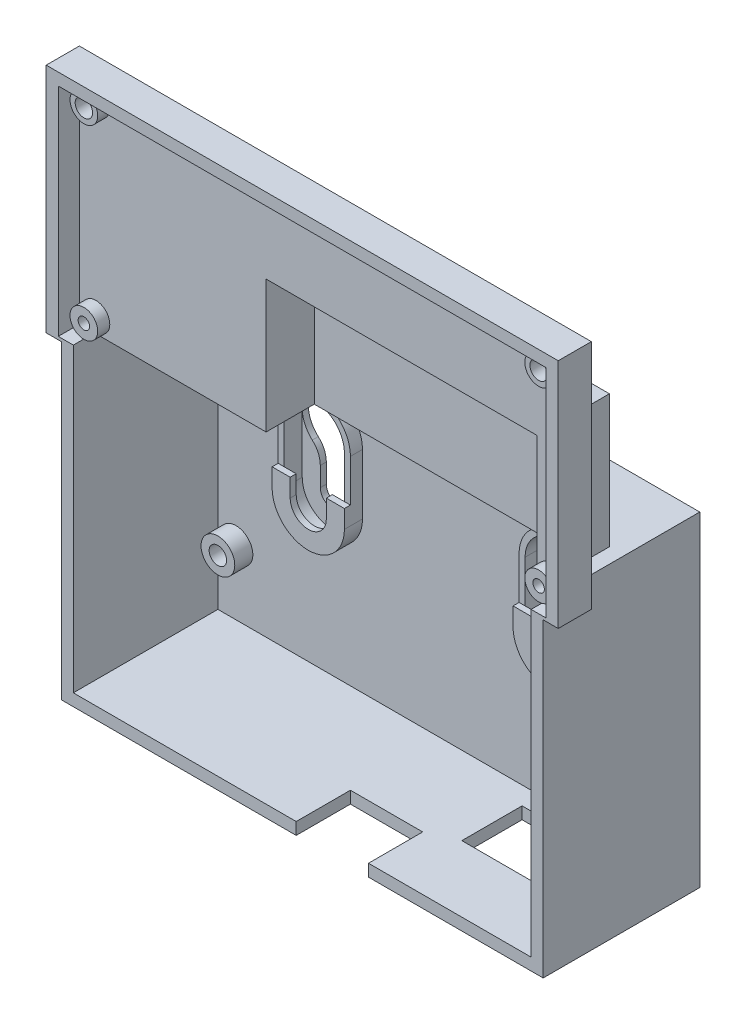
from build123d import *
from build123d.topology import SkipClean

# Parameters (mm, degrees)
SKETCH_1_W           = 80
SKETCH_1_H           = 54
SKETCH_1_W_2         = 76
SKETCH_1_H_2         = 50
EXTRUDE_1_DEPTH      = 24
SKETCH_2_W           = 80
SKETCH_2_H           = 54
EXTRUDE_1_2_DEPTH    = 2
SKETCH_3_R           = 2.8
SKETCH_3_R_2         = 1.45
EXTRUDE_4_DEPTH      = 3
SKETCH_4_W           = 16
SKETCH_4_H           = 10
SKETCH_4_W_2         = 12
SKETCH_4_H_2         = 9
CUT_EXTRUDE_1_DEPTH  = 2
SKETCH_6_W           = 10
SKETCH_6_H           = 12.5
CUT_EXTRUDE_2_DEPTH  = 2
CUT_EXTRUDE_START    = -2
SKETCH_7_R           = 1.45
CUT_EXTRUDE_3_DEPTH  = 2
SKETCH_8_W           = 81
SKETCH_8_H           = 5.5
CUT_EXTRUDE_4_DEPTH  = 2
EXTRUDE_5_DEPTH      = 2
EXTRUDE_6_DEPTH      = 3.5
SKETCH_11_W          = 45
SKETCH_11_H          = 22
CUT_EXTRUDE_5_DEPTH  = 8
EXTRUDE_7_DEPTH      = 6
SKETCH_13_W          = 53
SKETCH_13_H          = 22
EXTRUDE_8_DEPTH      = 2
SKETCH_14_R          = 2.3
SKETCH_14_R_2        = 1.45
SKETCH_14_R_3        = 0.95
EXTRUDE_9_DEPTH      = 2
SKETCH_15_R          = 1.45
CUT_EXTRUDE_6_DEPTH  = 2
EXTRUDE_10_DEPTH     = 2
CUT_EXTRUDE_7_DEPTH  = 2
EXTRUDE_11_DEPTH     = 1
CUT_EXTRUDE_START_2  = -1
CUT_EXTRUDE_8_DEPTH  = 1
SKETCH_20_R          = 3
CUT_EXTRUDE_9_DEPTH  = 1
SKETCH_21_R          = 3
CUT_EXTRUDE_10_DEPTH = 1


with BuildPart() as part:
    # Эскиз1 → Extrude 1 (new body)
    with BuildSketch(Plane.XY):
        Rectangle(SKETCH_1_W, SKETCH_1_H)
        Rectangle(SKETCH_1_W_2, SKETCH_1_H_2, mode=Mode.SUBTRACT)
    extrude(amount=EXTRUDE_1_DEPTH)

    # Эскиз2 → Extrude 1 2 (add)
    with BuildSketch(Plane(origin=(0, 0, 0), x_dir=(-1, 0, 0), z_dir=(0, 0, -1))):
        Rectangle(SKETCH_2_W, SKETCH_2_H)
    extrude(amount=EXTRUDE_1_2_DEPTH)

    # Эскиз3 → Бобышка-Вытянуть4 (add)
    # profile 1 of 4: a face of its own
    with BuildSketch(Plane.XY):
        with Locations((35, 19.75)):
            Circle(SKETCH_3_R)
        with Locations((35, 19.75)):
            Circle(SKETCH_3_R_2, mode=Mode.SUBTRACT)
    # profile 2 of 4: a face of its own
    with BuildSketch(Plane.XY):
        with Locations((35, -14.25)):
            Circle(SKETCH_3_R)
        with Locations((35, -14.25)):
            Circle(SKETCH_3_R_2, mode=Mode.SUBTRACT)
    # profile 3 of 4: a face of its own
    with BuildSketch(Plane.XY):
        with Locations((-35, -14.25)):
            Circle(SKETCH_3_R)
        with Locations((-35, -14.25)):
            Circle(SKETCH_3_R_2, mode=Mode.SUBTRACT)
    # profile 4 of 4: a face of its own
    with BuildSketch(Plane.XY):
        with Locations((-35, 19.75)):
            Circle(SKETCH_3_R)
        with Locations((-35, 19.75)):
            Circle(SKETCH_3_R_2, mode=Mode.SUBTRACT)
    extrude(amount=EXTRUDE_4_DEPTH)

    # Эскиз4 → Вырез-Вытянуть1 (cut)
    with BuildSketch(Plane.XZ.offset(27)):
        with Locations((23.5, 8)):
            Rectangle(SKETCH_4_W, SKETCH_4_H)
        with Locations((5, 19.5)):
            Rectangle(SKETCH_4_W_2, SKETCH_4_H_2)
    extrude(amount=-CUT_EXTRUDE_1_DEPTH, mode=Mode.SUBTRACT)

    # Эскиз6 → Вырез-Вытянуть2 (cut)
    with BuildSketch(Plane(origin=(0, 27, 0), x_dir=(1, 0, 0), z_dir=(0, 1, 0))):
        with Locations((-26.5, -10.25)):
            Rectangle(SKETCH_6_W, SKETCH_6_H)
    extrude(amount=-CUT_EXTRUDE_2_DEPTH, mode=Mode.SUBTRACT)

    # Эскиз7 → Вырез-Вытянуть3 (cut)
    with BuildSketch(Plane.XY.offset(CUT_EXTRUDE_START)):
        with Locations((-35, 19.75)):
            Circle(SKETCH_7_R)
        with Locations((-35, -14.25)):
            Circle(SKETCH_7_R)
        with Locations((35, 19.75)):
            Circle(SKETCH_7_R)
        with Locations((35, -14.25)):
            Circle(SKETCH_7_R)
    extrude(amount=CUT_EXTRUDE_3_DEPTH, mode=Mode.SUBTRACT)

    # Эскиз8 → Вырез-Вытянуть4 (cut)
    with BuildSketch(Plane(origin=(0, 27, 0), x_dir=(1, 0, 0), z_dir=(0, 1, 0))):
        with Locations((0, -21.25)):
            Rectangle(SKETCH_8_W, SKETCH_8_H)
    extrude(amount=-CUT_EXTRUDE_4_DEPTH, mode=Mode.SUBTRACT)

    # Эскиз9 → Бобышка-Вытянуть5 (add)
    with BuildSketch(Plane.XY.offset(18.5)):
        Polygon((42.5, 25), (42.5, 63), (-42.5, 63), (-42.5, 25), (-42.5, 24.5), (-40, 24.5), (-40, 25), (40, 25), (40, 24.5), (42.5, 24.5), align=None)
    extrude(amount=EXTRUDE_5_DEPTH)

    # Эскиз10 → Бобышка-Вытянуть6 (add)
    with BuildSketch(Plane.XY.offset(20.5)):
        Polygon((40.5, 25), (40.5, 61), (-40.5, 61), (-40.5, 25), (-40, 25), (-40, 24.5), (-42.5, 24.5), (-42.5, 25), (-42.5, 63), (42.5, 63), (42.5, 25), (42.5, 24.5), (40, 24.5), (40, 25), align=None)
    extrude(amount=EXTRUDE_6_DEPTH)

    # Эскиз11 → Вырез-Вытянуть5 (cut)
    with BuildSketch(Plane.XY.offset(20.5)):
        with Locations((13, 36)):
            Rectangle(SKETCH_11_W, SKETCH_11_H)
    extrude(amount=-CUT_EXTRUDE_5_DEPTH, mode=Mode.SUBTRACT)

    # Эскиз12 → Бобышка-Вытянуть7 (add)
    with BuildSketch(Plane(origin=(0, 0, 18.5), x_dir=(-1, 0, 0), z_dir=(0, 0, -1))):
        Polygon((9.5, 27), (15.5, 27), (15.5, 49), (-37.5, 49), (-37.5, 27), (-35.5, 27), (-35.5, 47), (9.5, 47), align=None)
    extrude(amount=EXTRUDE_7_DEPTH)

    # Эскиз13 → Бобышка-Вытянуть8 (add)
    with BuildSketch(Plane(origin=(0, 0, 12.5), x_dir=(-1, 0, 0), z_dir=(0, 0, -1))):
        with Locations((-11, 38)):
            Rectangle(SKETCH_13_W, SKETCH_13_H)
    extrude(amount=EXTRUDE_8_DEPTH)

    # Эскиз14 → Бобышка-Вытянуть9 (add)
    # profile 1 of 4: a face of its own
    with BuildSketch(Plane.XY.offset(20.5)):
        with Locations((37.75, 58.5)):
            Circle(SKETCH_14_R)
        with Locations((37.75, 58.5)):
            Circle(SKETCH_14_R_2, mode=Mode.SUBTRACT)
    # profile 2 of 4: a face of its own
    with BuildSketch(Plane.XY.offset(20.5)):
        with Locations(Location((37.75, 27.5, 0), (0, 0, 191.968745555))):
            Circle(SKETCH_14_R)
        with Locations((37.75, 27.5)):
            Circle(SKETCH_14_R_3, mode=Mode.SUBTRACT)
    # profile 3 of 4: a face of its own
    with BuildSketch(Plane.XY.offset(20.5)):
        with Locations((-37.75, 58.5)):
            Circle(SKETCH_14_R)
        with Locations((-37.75, 58.5)):
            Circle(SKETCH_14_R_2, mode=Mode.SUBTRACT)
    # profile 4 of 4: a face of its own
    with BuildSketch(Plane.XY.offset(20.5)):
        with Locations((-37.75, 27.5)):
            Circle(SKETCH_14_R)
        with Locations((-37.75, 27.5)):
            Circle(SKETCH_14_R_3, mode=Mode.SUBTRACT)
    extrude(amount=EXTRUDE_9_DEPTH)

    # Эскиз15 → Вырез-Вытянуть6 (cut)
    with BuildSketch(Plane.XY.offset(20.5).offset(CUT_EXTRUDE_START)):
        with Locations((-37.75, 58.5)):
            Circle(SKETCH_15_R)
        with Locations((37.75, 58.5)):
            Circle(SKETCH_15_R)
    extrude(amount=CUT_EXTRUDE_6_DEPTH, mode=Mode.SUBTRACT)

    # Эскиз16 → Бобышка-Вытянуть10 (add)
    # profile 1 of 2: a face of its own
    with BuildSketch(Plane.XY):
        with BuildLine():
            Line((-14, 10), (-14, 0))
            ThreePointArc((-14, 0), (-20, -6), (-26, 0))
            Line((-26, 0), (-26, 10))
            ThreePointArc((-26, 10), (-20, 16), (-14, 10))
        make_face()
        with BuildLine():
            Line((-25, 10), (-25, 0))
            ThreePointArc((-25, 0), (-20, -5), (-15, 0))
            Line((-15, 0), (-15, 10))
            ThreePointArc((-15, 10), (-20, 15), (-25, 10))
        make_face(mode=Mode.SUBTRACT)
    # profile 2 of 2: a face of its own
    with BuildSketch(Plane.XY):
        with BuildLine():
            Line((26, 10), (26, 0))
            ThreePointArc((26, 0), (20, -6), (14, 0))
            Line((14, 0), (14, 10))
            ThreePointArc((14, 10), (20, 16), (26, 10))
        make_face()
        with BuildLine():
            Line((15, 10), (15, 0))
            ThreePointArc((15, 0), (20, -5), (25, 0))
            Line((25, 0), (25, 10))
            ThreePointArc((25, 10), (20, 15), (15, 10))
        make_face(mode=Mode.SUBTRACT)
    extrude(amount=EXTRUDE_10_DEPTH)

    # Эскиз17 → Вырез-Вытянуть7 (cut)
    with SkipClean():  # the faces are left unmerged after this step: merging them gives an invalid solid
        with BuildSketch(Plane.XY.offset(CUT_EXTRUDE_START)):
            with BuildLine():
                Line((-18, 2), (-18, 3.195989192))
                ThreePointArc((-18, 3.195989192), (-17.651483717, 4.828982354), (-16.666666667, 6.177413162))
                ThreePointArc((-16.666666667, 6.177413162), (-20, 14.904193125), (-23.333333333, 6.177413162))
                ThreePointArc((-23.333333333, 6.177413162), (-22.348516283, 4.828982354), (-22, 3.195989192))
                Line((-22, 3.195989192), (-22, 2))
                Line((-22, 2), (-22, 0))
                ThreePointArc((-22, 0), (-20, -2), (-18, 0))
                Line((-18, 0), (-18, 2))
            make_face()
            with BuildLine():
                Line((18, 0), (18, 2))
                Line((18, 2), (18, 3.291796068))
                ThreePointArc((18, 3.291796068), (17.651483717, 4.924789229), (16.666666667, 6.273220038))
                ThreePointArc((16.666666667, 6.273220038), (20, 15), (23.333333333, 6.273220038))
                ThreePointArc((23.333333333, 6.273220038), (22.348516283, 4.924789229), (22, 3.291796068))
                Line((22, 3.291796068), (22, 2))
                Line((22, 2), (22, 0))
                ThreePointArc((22, 0), (20, -2), (18, 0))
            make_face()
        extrude(amount=CUT_EXTRUDE_7_DEPTH, mode=Mode.SUBTRACT)

    # Эскиз18 → Бобышка-Вытянуть11 (add)
    with SkipClean():  # the faces are left unmerged after this step: merging them gives an invalid solid
        with BuildSketch(Plane.XY.offset(2)):
            with BuildLine():
                Line((22, 0), (22, 3))
                Line((22, 3), (26, 3))
                Line((26, 3), (26, 0))
                ThreePointArc((26, 0), (20, -6), (14, 0))
                Line((14, 0), (14, 3))
                Line((14, 3), (15, 3))
                Line((15, 3), (18, 3))
                Line((18, 3), (18, 0))
                ThreePointArc((18, 0), (20, -2), (22, 0))
            make_face()
            with BuildLine():
                Line((-14, 0), (-14, 3))
                Line((-14, 3), (-17, 3))
                Line((-17, 3), (-17, 0))
                ThreePointArc((-17, 0), (-20, -3), (-23, 0))
                Line((-23, 0), (-23, 3))
                Line((-23, 3), (-26, 3))
                Line((-26, 3), (-26, 0))
                ThreePointArc((-26, 0), (-20, -6), (-14, 0))
            make_face()
        extrude(amount=EXTRUDE_11_DEPTH)

    # Эскиз19 → Вырез-Вытянуть8 (cut)
    with BuildSketch(Plane.XY.offset(CUT_EXTRUDE_START_2)):
        with BuildLine():
            Line((-25, 0), (-25, 10))
            ThreePointArc((-25, 10), (-20, 15), (-15, 10))
            Line((-15, 10), (-15, 0))
            ThreePointArc((-15, 0), (-20, -5), (-25, 0))
        make_face()
        with BuildLine():
            Line((25, 10), (25, 0))
            ThreePointArc((25, 0), (20, -5), (15, 0))
            Line((15, 0), (15, 10))
            ThreePointArc((15, 10), (20, 15), (25, 10))
        make_face()
    extrude(amount=CUT_EXTRUDE_8_DEPTH, mode=Mode.SUBTRACT)

    # Эскиз20 → Вырез-Вытянуть9 (cut)
    with BuildSketch(Plane(origin=(0, 0, -2), x_dir=(-1, 0, 0), z_dir=(0, 0, -1))):
        with Locations((35, -14.25)):
            Circle(SKETCH_20_R)
        with Locations((35, 19.75)):
            Circle(SKETCH_20_R)
        with Locations((-35, -14.25)):
            Circle(SKETCH_20_R)
        with Locations((-35, 19.75)):
            Circle(SKETCH_20_R)
    extrude(amount=-CUT_EXTRUDE_9_DEPTH, mode=Mode.SUBTRACT)

    # Эскиз21 → Вырез-Вытянуть10 (cut)
    with BuildSketch(Plane(origin=(0, 0, 18.5), x_dir=(-1, 0, 0), z_dir=(0, 0, -1))):
        with Locations((37.75, 58.5)):
            Circle(SKETCH_21_R)
        with Locations((-37.75, 58.5)):
            Circle(SKETCH_21_R)
    extrude(amount=-CUT_EXTRUDE_10_DEPTH, mode=Mode.SUBTRACT)


solid = part.part
